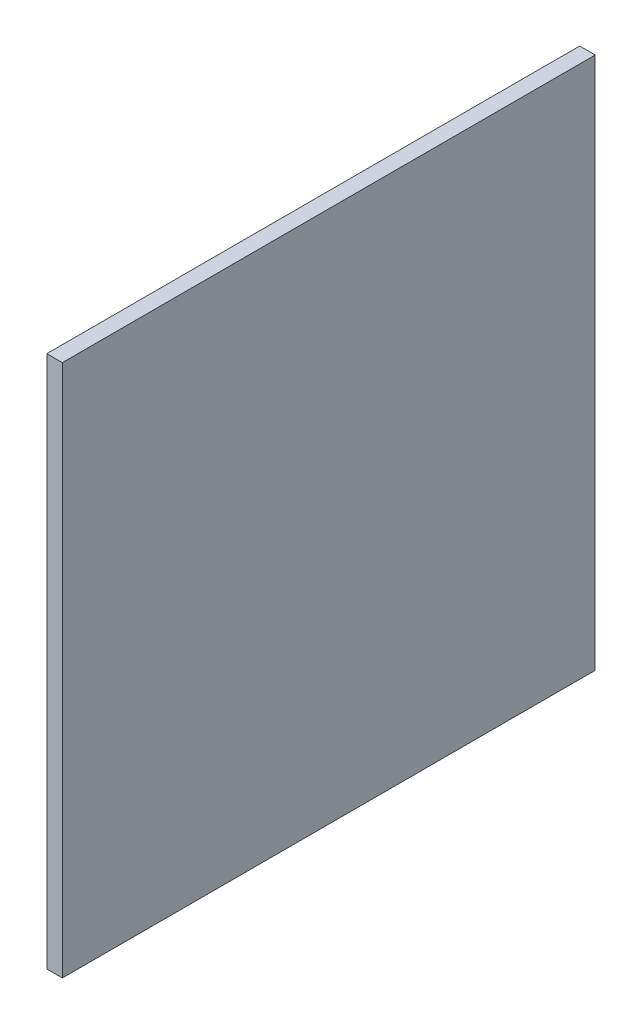
from build123d import *

# Parameters (mm, degrees)
SKETCH1_W           = 68.6
SKETCH1_H           = 68.6
BOSS_EXTRUDE1_DEPTH = 2


with BuildPart() as part:
    # Sketch1 → Boss-Extrude1 (new body)
    with BuildSketch(Plane(origin=(0, 0, 0), x_dir=(0, 0, -1), z_dir=(1, 0, 0))):
        with Locations((34.3, 34.3)):
            Rectangle(SKETCH1_W, SKETCH1_H)
    extrude(amount=-BOSS_EXTRUDE1_DEPTH)


solid = part.part
